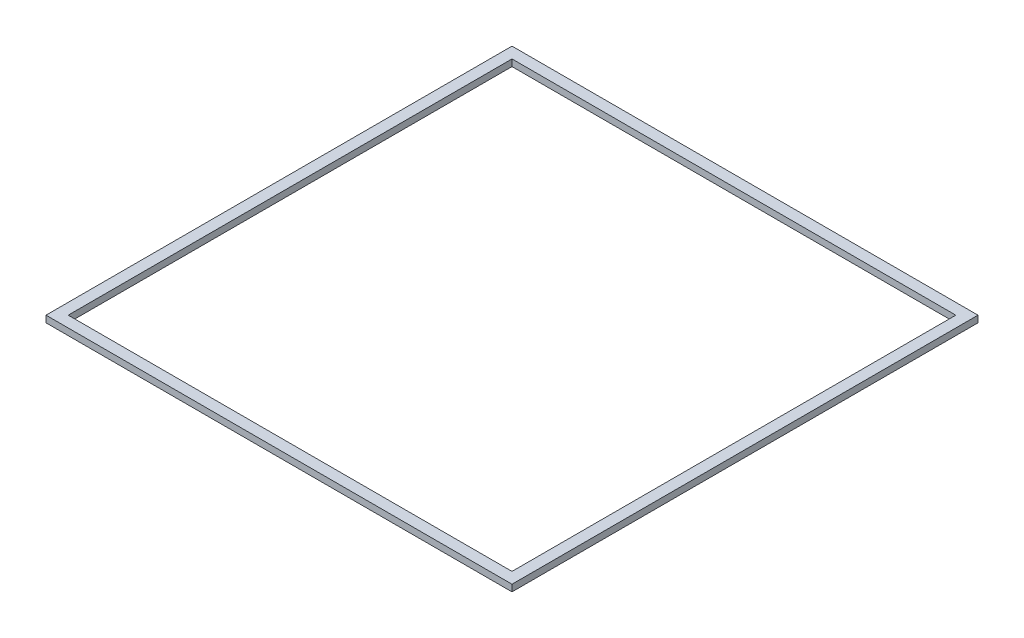
from build123d import *

# Parameters (mm, degrees)
SKETCH1_W           = 210
SKETCH1_H           = 210
SKETCH1_W_2         = 200
SKETCH1_H_2         = 200
BOSS_EXTRUDE1_DEPTH = 3


with BuildPart() as part:
    # Sketch1 → Boss-Extrude1 (new body)
    with BuildSketch(Plane(origin=(0, 0, 0), x_dir=(1, 0, 0), z_dir=(0, 1, 0))):
        with Locations((105, 132.290035766)):
            Rectangle(SKETCH1_W, SKETCH1_H)
        with Locations((105, 132.290035766)):
            Rectangle(SKETCH1_W_2, SKETCH1_H_2, mode=Mode.SUBTRACT)
    extrude(amount=BOSS_EXTRUDE1_DEPTH)


solid = part.part
